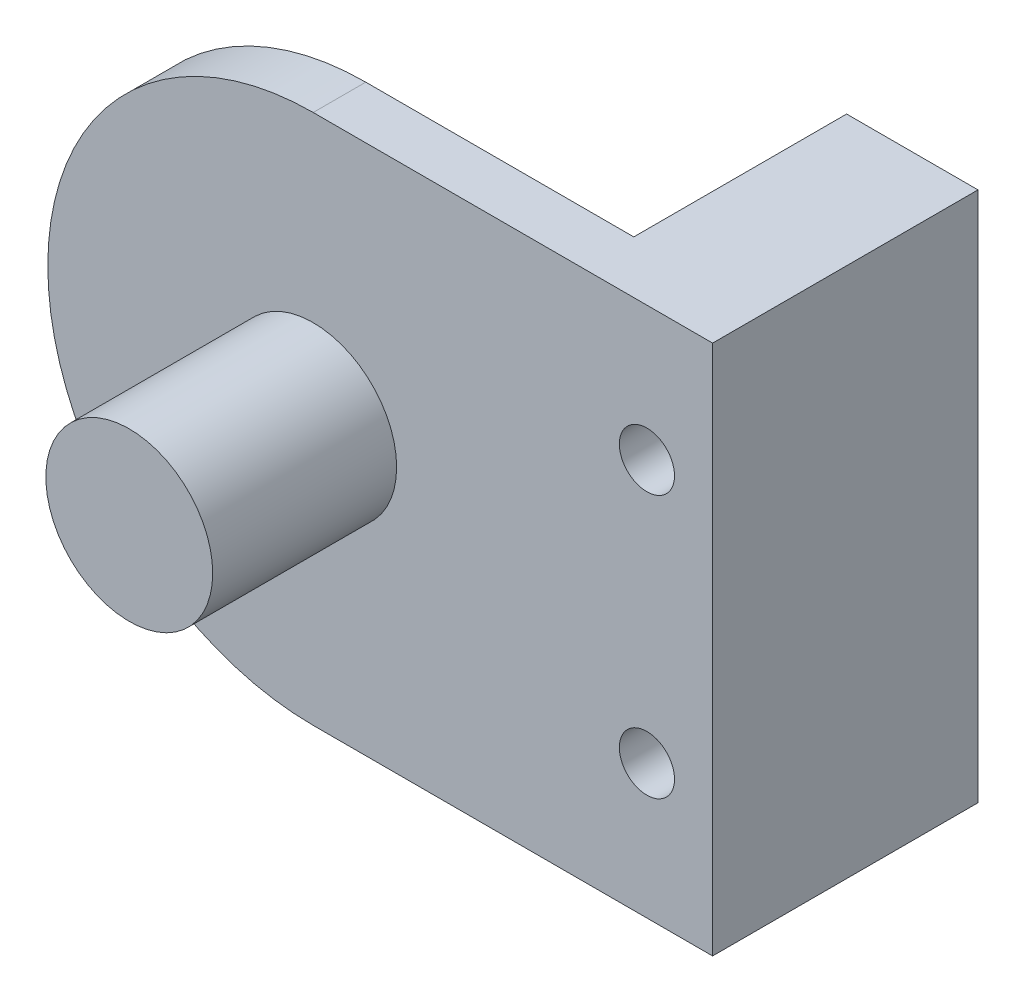
from build123d import *

# Parameters (mm, degrees)
ESQUISSE1_W             = 5
ESQUISSE1_H             = 20.2
BOSS_EXTRU_1_DEPTH      = 8.1
BOSS_EXTRU_2_DEPTH      = 2
ESQUISSE3_R             = 3.175
BOSS_EXTRU_3_DEPTH      = 7
ESQUISSE4_R             = 1.05
ENL_V_MAT_EXTRU_1_DEPTH = 31.236732628


with BuildPart() as part:
    # Esquisse1 → Boss.-Extru.1 (new body)
    with BuildSketch(Plane.XY):
        Rectangle(ESQUISSE1_W, ESQUISSE1_H)
    extrude(amount=BOSS_EXTRU_1_DEPTH)

    # Esquisse2 → Boss.-Extru.2 (add)
    with BuildSketch(Plane.XY.offset(8.1)):
        with BuildLine():
            Line((2.5, 10.1), (-12.7, 10.1))
            ThreePointArc((-12.7, 10.1), (-22.8, 0), (-12.7, -10.1))
            Line((-12.7, -10.1), (2.5, -10.1))
            Line((2.5, -10.1), (2.5, 10.1))
        make_face()
    extrude(amount=BOSS_EXTRU_2_DEPTH)

    # Esquisse3 → Boss.-Extru.3 (add)
    with BuildSketch(Plane.XY.offset(10.1)):
        with Locations((-12.7, 0)):
            Circle(ESQUISSE3_R)
    extrude(amount=BOSS_EXTRU_3_DEPTH)

    # Esquisse4 → Enlèv. mat.-Extru.1 (cut, through all)
    with BuildSketch(Plane(origin=(0, 0, 0), x_dir=(-1, 0, 0), z_dir=(0, 0, -1))):
        with Locations((0, 5)):
            Circle(ESQUISSE4_R)
        with Locations((0, -5)):
            Circle(ESQUISSE4_R)
    extrude(amount=-ENL_V_MAT_EXTRU_1_DEPTH, mode=Mode.SUBTRACT)


solid = part.part
